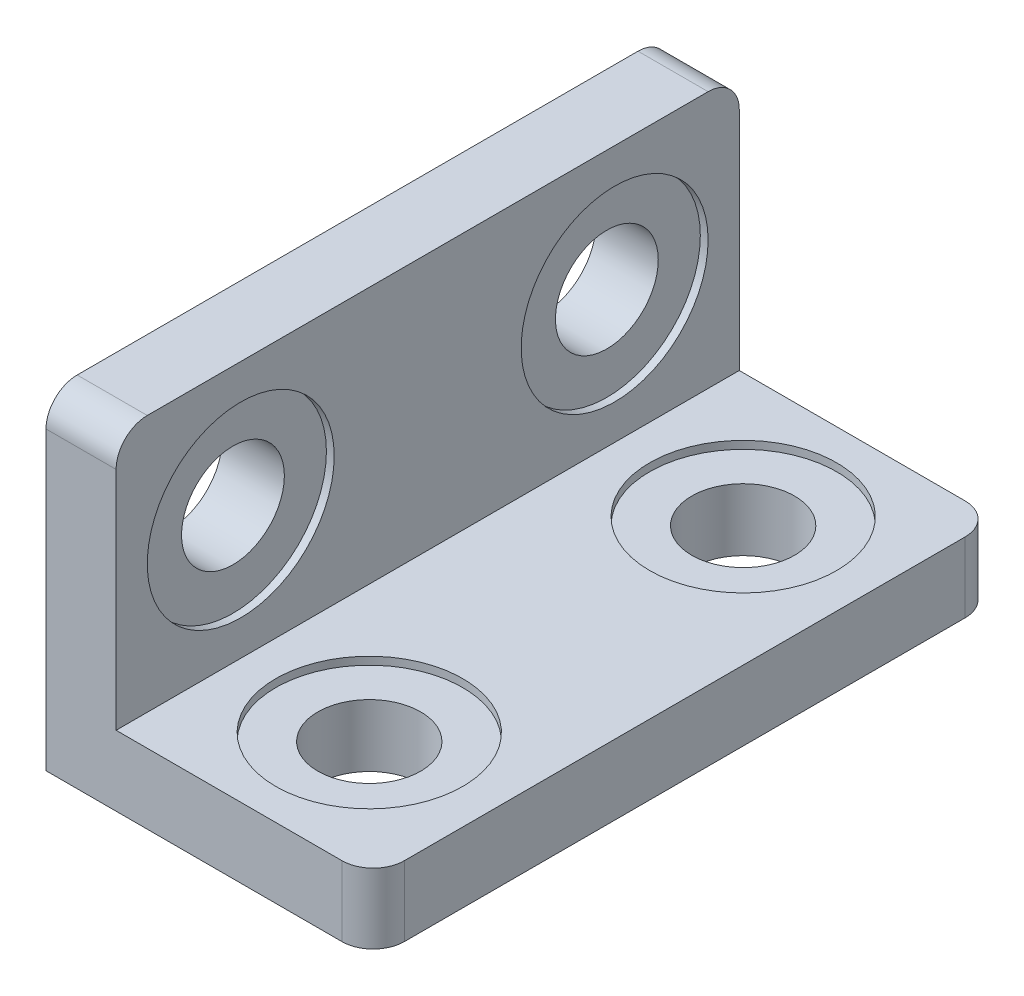
from build123d import *

# Parameters (mm, degrees)
EXTRUDE_1_DEPTH              = 20
HOLE_WIZARD_M6_1_D           = 6.6
HOLE_WIZARD_M6_1_CBORE_D     = 12
HOLE_WIZARD_M6_1_CBORE_DEPTH = 0.5
HOLE_WIZARD_M6_2_D           = 6.6
HOLE_WIZARD_M6_2_CBORE_D     = 12
HOLE_WIZARD_M6_2_CBORE_DEPTH = 0.5
FILLET_1_R                   = 2


with BuildPart() as part:
    # 草图1 → 凸台-拉伸1 (new, symmetric)
    with BuildSketch(Plane.XY):
        Polygon((0, 21), (0, 0), (21, 0), (21, 4.5), (4.5, 4.5), (4.5, 21), align=None)
    extrude(amount=EXTRUDE_1_DEPTH, both=True)

    # M6 六角头螺栓的柱形沉头孔1 (through all)
    with Locations(Plane(origin=(0, 4.5, 0), x_dir=(1, 0, 0), z_dir=(0, 1, 0))):
        with Locations((12.75, 12), (12.75, -12)):
            CounterBoreHole(HOLE_WIZARD_M6_1_D / 2, HOLE_WIZARD_M6_1_CBORE_D / 2, HOLE_WIZARD_M6_1_CBORE_DEPTH)

    # M6 六角头螺栓的柱形沉头孔2 (through all)
    with Locations(Plane(origin=(4.5, 0, 0), x_dir=(0, 0, -1), z_dir=(1, 0, 0))):
        with Locations((12, 12.75), (-12, 12.75)):
            CounterBoreHole(HOLE_WIZARD_M6_2_D / 2, HOLE_WIZARD_M6_2_CBORE_D / 2, HOLE_WIZARD_M6_2_CBORE_DEPTH)

    # 圆角1
    fillet_1_edges = [part.edges().sort_by_distance(p)[0] for p in [
        (21, 2.25, 20),
        (2.25, 21, 20),
        (21, 2.25, -20),
        (2.25, 21, -20),
    ]]
    fillet(fillet_1_edges, radius=FILLET_1_R)


solid = part.part
